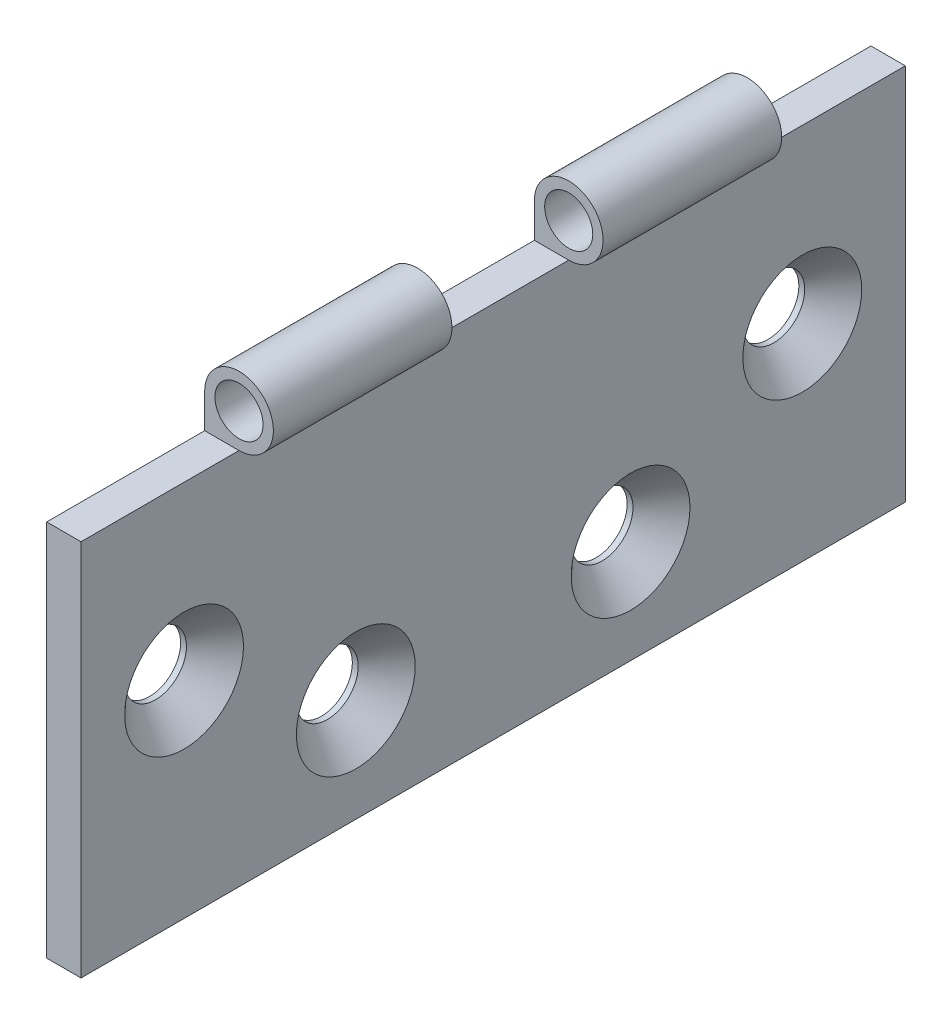
from build123d import *

# Parameters (mm, degrees)
SKETCH_1_W                 = 5
SKETCH_1_H                 = 60
EXTRUDE_1_DEPTH            = 60
SKETCH_2_R                 = 5
SKETCH_4_R                 = 3.5
CUT_EXTRUDE_1_DEPTH        = 137.839321834
HOLE_WIZARD_M81_AT_2_COUNT = 2
HOLE_WIZARD_M81_AT_2_PITCH = 29.154759474
CUT_EXTRUDE_2_DEPTH        = 89.600225733
CUT_EXTRUDE_2_DEPTH_BACK   = 89.600225733
SKETCH_7_W                 = 23
SKETCH_7_H                 = 10
SKETCH_7_W_2               = 22


with BuildPart() as part:
    # Эскиз1 → Вытянуть-Тонкостенный1 (new, symmetric)
    with BuildSketch(Plane.XY):
        with Locations((2.5, 30)):
            Rectangle(SKETCH_1_W, SKETCH_1_H)
    extrude(amount=EXTRUDE_1_DEPTH, both=True)

    # По траектории1: sweep along a curve in space
    with BuildLine() as sweep_1_path:
        Line((5, 60, 60), (5, 60, -60))
    # Эскиз2 → По траектории1 (sweep)
    with BuildSketch(Plane.XY.offset(60)):
        with Locations((5, 60)):
            Circle(SKETCH_2_R)
    sweep(path=sweep_1_path.line)

    # Эскиз4 → Вырез-Вытянуть1 (cut, through all)
    with BuildSketch(Plane.XY.offset(60)):
        with Locations((5, 60)):
            Circle(SKETCH_4_R)
    extrude(amount=-CUT_EXTRUDE_1_DEPTH, mode=Mode.SUBTRACT)

    # Эскиз5 → Зенковка для  винта с плоской головкой M81 (revolve, cut)
    with BuildSketch(Plane(origin=(5, 30, 45), x_dir=(0, 0, -1), z_dir=(0, 1, 0))):
        Polygon((0, 0), (0, 5), (4.5, 5), (4.5, 4.15), (8.65, 0), align=None)
    hole_wizard_m81 = revolve(axis=Axis((11.35, 30, 45), (-1, 0, 0)), mode=Mode.SUBTRACT)

    # Зенковка для  винта с плоской головкой M81 at 2: Зенковка для  винта с плоской головкой M81 ×2
    with Locations(*[Vector(0, -0.5144957554275265, -0.8574929257125442) * (i * HOLE_WIZARD_M81_AT_2_PITCH) for i in range(1, HOLE_WIZARD_M81_AT_2_COUNT)]):
        add(hole_wizard_m81, mode=Mode.SUBTRACT)

    # Зеркальное отражение1: Зенковка для  винта с плоской головкой M81 across plane
    add(hole_wizard_m81.mirror(Plane.XY), mode=Mode.SUBTRACT)

    # Зеркальное отражение1 copy 1 sketch → Зеркальное отражение1 copy 1 (revolve, cut)
    with BuildSketch(Plane(origin=(5, 15, -20), x_dir=(0, 0, 1), z_dir=(0, 1, 0))):
        Polygon((0, 0), (0, -5), (4.5, -5), (4.5, -4.15), (8.65, 0), align=None)
    revolve(axis=Axis((11.35, 15, -20), (1, 0, 0)), mode=Mode.SUBTRACT)

    # Эскиз7 → Вырез-Вытянуть2 (cut, two sides: drawn at the far end of the back side and taken through both)
    with BuildSketch(Plane(origin=(5, 0, 0), x_dir=(0, 0, -1), z_dir=(1, 0, 0)).offset(-CUT_EXTRUDE_2_DEPTH_BACK)):
        with Locations((48.5, 60)):
            Rectangle(SKETCH_7_W, SKETCH_7_H)
        with Locations((0, 60)):
            Rectangle(SKETCH_7_W_2, SKETCH_7_H)
        with Locations((-48.5, 60)):
            Rectangle(SKETCH_7_W, SKETCH_7_H)
    extrude(amount=CUT_EXTRUDE_2_DEPTH + CUT_EXTRUDE_2_DEPTH_BACK, mode=Mode.SUBTRACT)


solid = part.part
